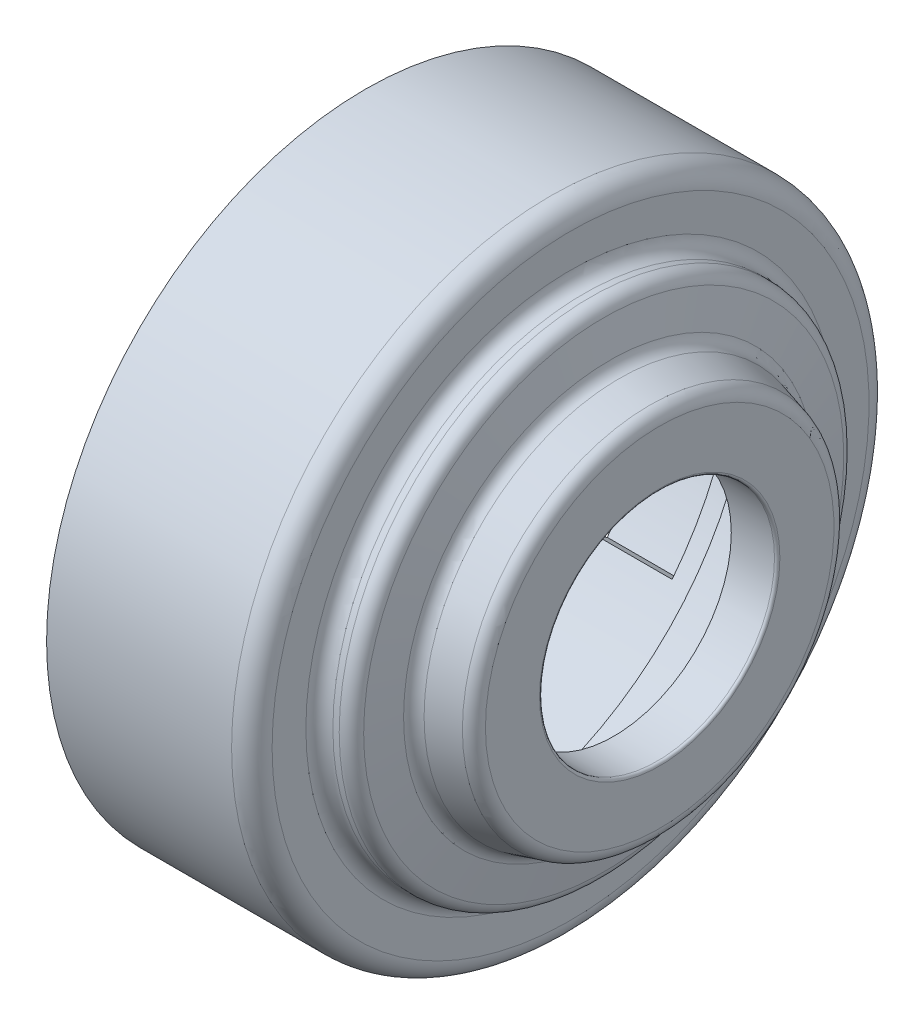
from build123d import *

# Parameters (mm, degrees)
FILLET_1_R               = 0.2
FILLET_2_R               = 1
FILLET_3_R               = 1.5
CUT_EXTRUDE_START        = -1
CUT_EXTRUDE_1_DEPTH      = 1
CUT_EXTRUDE_START_2      = -5.5
CUT_EXTRUDE_2_DEPTH      = 5.5
SKETCH_5_W               = 2.200000000000001
SKETCH_5_H               = 1.458146796235166
CUT_REVOLVE_1_ANGLE      = 24.000000000000053
CUT_EXTRUDE_3_REACH      = 51.835
CUT_EXTRUDE_3_END_RADIUS = 22.8
PATTERN_CIRCULAR_1_COUNT = 3
CUT_EXTRUDE_5_REACH      = 40.16
PATTERN_CIRCULAR_3_COUNT = 3
CUT_EXTRUDE_6_REACH      = 40.16
CUT_EXTRUDE_7_REACH      = 40.16


with BuildPart() as part:
    # 草图2 → 旋转1 (revolve)
    with BuildSketch(Plane.XY, mode=Mode.PRIVATE) as revolve_1_sk:
        Polygon((-13.999999999999998, 22), (-6.899999999999999, 22), (-6.899999999999999, 21.599999999999998), (1.73e-15, 21.599999999999998), (2.28e-15, 17.4), (2.500000000000002, 17.4), (3.157262574057294, 13.672478713033763), (6.600000000000001, 12.75), (6.600000000000003, 9.4), (4.400000000000003, 9.4), (4.400000000000003, 8.700000000000001), (7.800000000000003, 8.700000000000001), (7.800000000000003, 13.670792385574746), (4.206280569869923, 14.633726604702153), (3.506919557412737, 18.599999999999998), (1.200000000000002, 18.599999999999998), (1.2000000000000015, 23.599999999999998), (-13.999999999999998, 23.599999999999998), align=None)
    revolve(revolve_1_sk.sketch.rotate(Axis((-36.93660531697341, 0, 0), (1, 0, 0)), 90), axis=Axis((-36.93660531697341, 0, 0), (1, 0, 0)))

    # 圆角1
    fillet_1_edges = [part.edges().sort_by_distance(p)[0] for p in [
        (0, 4.55e-15, -21.599999999999998),
        (0, -4.06e-15, -17.4),
        (2.5, -4.06e-15, -17.4),
        (6.600000000000001, -2.98e-15, -12.75),
        (7.800000000000004, -2.03e-15, -8.700000000000001),
    ]]
    fillet(fillet_1_edges, radius=FILLET_1_R)

    # 圆角2
    fillet_2_edges = [part.edges().sort_by_distance(p)[0] for p in [
        (7.800000000000004, -3.19e-15, -13.670792385574746),
        (4.206280569869925, -3.42e-15, -14.633726604702153),
        (3.5069195574127363, -4.34e-15, -18.599999999999998),
        (1.2000000000000028, -4.34e-15, -18.599999999999998),
    ]]
    fillet(fillet_2_edges, radius=FILLET_2_R)

    # 圆角3
    fillet_3_edges = [part.edges().sort_by_distance(p)[0] for p in [
        (3.1572625740572917, -3.19e-15, -13.672478713033763),
        (1.2000000000000028, -5.51e-15, -23.599999999999998),
    ]]
    fillet(fillet_3_edges, radius=FILLET_3_R)

    # 草图3 → 切除-拉伸1 (cut)
    with BuildSketch(Plane.ZY.offset(13.999999999999998).offset(CUT_EXTRUDE_START)):
        with BuildLine():
            Line((-0.49999999999999933, 22.599999999999998), (0.5000000000000004, 22.599999999999998))
            Line((0.5000000000000004, 22.599999999999998), (0.5000000000000006, 21.99431744792277))
            ThreePointArc((0.5000000000000006, 21.99431744792277), (1.35e-15, 22), (-0.4999999999999993, 21.99431744792277))
            Line((-0.4999999999999993, 21.99431744792277), (-0.49999999999999933, 22.599999999999998))
        make_face()
    extrude(amount=CUT_EXTRUDE_1_DEPTH, mode=Mode.SUBTRACT)

    # 草图4 → 切除-拉伸2 (cut)
    with BuildSketch(Plane.ZY.offset(13.999999999999998).offset(CUT_EXTRUDE_START_2)):
        with BuildLine():
            Line((-3.2499999999999982, 22.56717749298747), (-3.2499999999999987, 21.75861898191151))
            ThreePointArc((-3.2499999999999987, 21.75861898191151), (1.35e-15, 21.999999999999996), (3.2500000000000013, 21.75861898191151))
            Line((3.2500000000000013, 21.75861898191151), (3.2500000000000018, 22.567177492987465))
            ThreePointArc((3.2500000000000018, 22.567177492987465), (1.4e-15, 22.8), (-3.2499999999999982, 22.56717749298747))
        make_face()
    cut_extrude_2 = extrude(amount=CUT_EXTRUDE_2_DEPTH, mode=Mode.SUBTRACT)

    # 草图5 → 切除-旋转1 (revolve, cut)
    with BuildSketch(Plane.XY):
        with Locations((-9.599999999999994, 22.070926601882412)):
            Rectangle(SKETCH_5_W, SKETCH_5_H)
    cut_revolve_1 = revolve(axis=Axis((16.624194515447005, 0, 0), (1, 0, 0)), revolution_arc=CUT_REVOLVE_1_ANGLE, mode=Mode.SUBTRACT)

    # 切除-拉伸3: up to this cylinder (the profile starts inside it)
    cut_extrude_3_end = Plane(origin=(-10.733154, 0, 0), z_dir=(-1, 0, 0)) * Cylinder(CUT_EXTRUDE_3_END_RADIUS, 150.27, mode=Mode.PRIVATE)
    # 草图6 → 切除-拉伸3 (cut, up to the surface)
    with BuildSketch(Plane(origin=(0, 18, 0), x_dir=(1, 0, 0), z_dir=(0, 1, 0)), mode=Mode.PRIVATE) as cut_extrude_3_sk1:
        Polygon((-10.699999999999994, -8.948206147667621), (-10.699999999999994, -3.2500000000000013), (-10.799462558281862, -8.948206147667621), align=None)
    cut_extrude_3_tool1 = extrude(cut_extrude_3_sk1.sketch, amount=CUT_EXTRUDE_3_REACH, mode=Mode.PRIVATE) & cut_extrude_3_end
    cut_extrude_3 = cut_extrude_3_tool1.solids().sort_by_distance((-10.733154, 18, 7.048804))[0]
    add(cut_extrude_3, mode=Mode.SUBTRACT)

    # 阵列(圆周)1: 切除-拉伸2, 切除-旋转1 ×3 about axis
    pattern_circular_1_axis = Axis((0, 5e-17, 2e-16), (1, 0, 0))
    add([cut_extrude_2.rotate(pattern_circular_1_axis, i * 360 / PATTERN_CIRCULAR_1_COUNT) for i in range(1, PATTERN_CIRCULAR_1_COUNT)], mode=Mode.SUBTRACT)
    add([cut_revolve_1.rotate(pattern_circular_1_axis, i * 360 / PATTERN_CIRCULAR_1_COUNT) for i in range(1, PATTERN_CIRCULAR_1_COUNT)], mode=Mode.SUBTRACT)

    # 切除-拉伸5: up to this face of the body (flat: up to its plane)
    cut_extrude_5_end = Plane(part.part.faces().sort_by_distance((-10.750360581, 21.4748312, 6.135155752))[0])
    # 草图9 → 切除-拉伸5 (cut, up to the picked face)
    with BuildSketch(Plane(origin=(-10.699999999999994, 0, 0), x_dir=(0, 0, -1), z_dir=(1, 0, 0)), mode=Mode.PRIVATE) as cut_extrude_5_sk1:
        with BuildLine():
            Line((-9.273595462128261, 20.82883643425129), (-8.948206147667621, 20.09800006813721))
            Line((-8.948206147667621, 20.09800006813721), (-8.948206147667618, 20.970684460428163))
            ThreePointArc((-8.948206147667618, 20.970684460428163), (-9.111176855506788, 20.90039368786333), (-9.273595462128261, 20.82883643425129))
        make_face()
    cut_extrude_5_tool1 = split(extrude(cut_extrude_5_sk1.sketch, amount=-CUT_EXTRUDE_5_REACH, mode=Mode.PRIVATE), bisect_by=cut_extrude_5_end, keep=Keep.BOTH, mode=Mode.PRIVATE)
    add(cut_extrude_5_tool1.solids().sort_by(Axis((-10.7, 20.632815, 9.056732), (-1, 0, 0)))[0], mode=Mode.SUBTRACT)

    # 阵列(圆周)3: 切除-拉伸3 ×3 about axis
    pattern_circular_3_axis = Axis((0, 0, 3e-17), (1, 0, 0))
    for i in range(1, PATTERN_CIRCULAR_3_COUNT):
        add(cut_extrude_3.rotate(pattern_circular_3_axis, i * 360 / PATTERN_CIRCULAR_3_COUNT), mode=Mode.SUBTRACT)

    # 切除-拉伸6: up to this face of the body (flat: up to its plane)
    cut_extrude_6_end = Plane(part.part.faces().sort_by_distance((-10.750360581, -5.424214863, -21.665327237))[0])
    # 草图10 → 切除-拉伸6 (cut, up to the picked face)
    with BuildSketch(Plane(origin=(-10.699999999999994, 0, 0), x_dir=(0, 0, -1), z_dir=(1, 0, 0)), mode=Mode.PRIVATE) as cut_extrude_6_sk1:
        with BuildLine():
            Line((22.675099214396656, -2.383248962502268), (21.879481698102033, -2.2996261918881546))
            Line((21.879481698102033, -2.2996261918881546), (22.63524855131219, -2.7359683880336263))
            ThreePointArc((22.63524855131219, -2.7359683880336263), (22.655860310538994, -2.5596862286897593), (22.675099214396656, -2.383248962502268))
        make_face()
    cut_extrude_6_tool1 = split(extrude(cut_extrude_6_sk1.sketch, amount=-CUT_EXTRUDE_6_REACH, mode=Mode.PRIVATE), bisect_by=cut_extrude_6_end, keep=Keep.BOTH, mode=Mode.PRIVATE)
    add(cut_extrude_6_tool1.solids().sort_by(Axis((-10.7, -2.473048, -22.396907), (-1, 0, 0)))[0], mode=Mode.SUBTRACT)

    # 切除-拉伸7: up to this face of the body (flat: up to its plane)
    cut_extrude_7_end = Plane(part.part.faces().sort_by_distance((-10.750360581, -16.050616337, 15.530171486))[0])
    # 草图11 → 切除-拉伸7 (cut, up to the picked face)
    with BuildSketch(Plane(origin=(-10.699999999999994, 0, 0), x_dir=(0, 0, -1), z_dir=(1, 0, 0)), mode=Mode.PRIVATE) as cut_extrude_7_sk1:
        with BuildLine():
            Line((-13.401503752268288, -18.445587471748876), (-12.93127555043432, -17.79837387624892))
            Line((-12.93127555043432, -17.79837387624892), (-13.687042403644462, -18.234716072394395))
            ThreePointArc((-13.687042403644462, -18.234716072394395), (-13.5446834550321, -18.340707459173426), (-13.401503752268288, -18.445587471748876))
        make_face()
    cut_extrude_7_tool1 = split(extrude(cut_extrude_7_sk1.sketch, amount=-CUT_EXTRUDE_7_REACH, mode=Mode.PRIVATE), bisect_by=cut_extrude_7_end, keep=Keep.BOTH, mode=Mode.PRIVATE)
    add(cut_extrude_7_tool1.solids().sort_by(Axis((-10.7, -18.159767, 13.340176), (-1, 0, 0)))[0], mode=Mode.SUBTRACT)


solid = part.part
